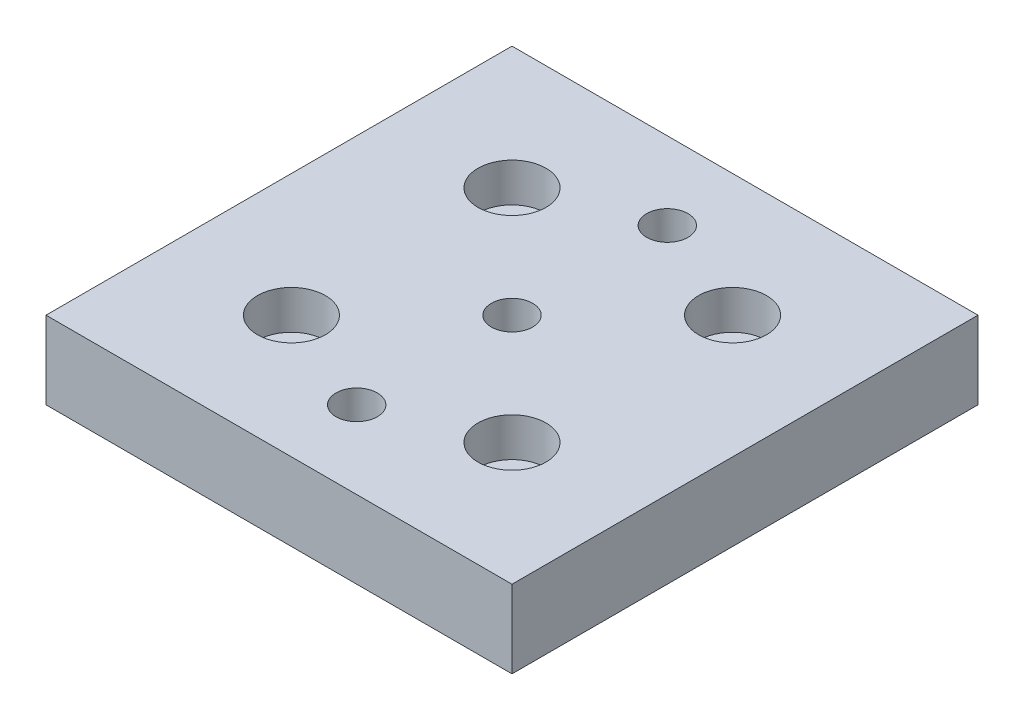
from build123d import *

# Parameters (mm, degrees)
SKETCH1_W                                        = 76.2
SKETCH1_H                                        = 76.2
BOSS_EXTRUDE1_DEPTH                              = 12.7
CBORE_FOR_1_4_SOCKET_HEAD_CAP_SCREW2_D           = 6.7564
CBORE_FOR_1_4_SOCKET_HEAD_CAP_SCREW2_CBORE_D     = 11.1125
CBORE_FOR_1_4_SOCKET_HEAD_CAP_SCREW2_CBORE_DEPTH = 6.35
CBORE_FOR_1_4_SOCKET_HEAD_CAP_SCREW1_D           = 6.7564
CBORE_FOR_1_4_SOCKET_HEAD_CAP_SCREW1_CBORE_D     = 11.1125
CBORE_FOR_1_4_SOCKET_HEAD_CAP_SCREW1_CBORE_DEPTH = 6.35


with BuildPart() as part:
    # Sketch1 → Boss-Extrude1 (new body)
    with BuildSketch(Plane(origin=(0, 0, 0), x_dir=(1, 0, 0), z_dir=(0, 1, 0))):
        Rectangle(SKETCH1_W, SKETCH1_H)
    extrude(amount=BOSS_EXTRUDE1_DEPTH)

    # CBORE for 1/4 Socket Head Cap Screw2 (through all)
    with Locations(Plane(origin=(0, 12.7, 0), x_dir=(1, 0, 0), z_dir=(0, 1, 0))):
        with Locations((-18.034, 18.034), (18.034, 18.034), (18.034, -18.034), (-18.034, -18.034)):
            CounterBoreHole(CBORE_FOR_1_4_SOCKET_HEAD_CAP_SCREW2_D / 2, CBORE_FOR_1_4_SOCKET_HEAD_CAP_SCREW2_CBORE_D / 2, CBORE_FOR_1_4_SOCKET_HEAD_CAP_SCREW2_CBORE_DEPTH)

    # CBORE for 1/4 Socket Head Cap Screw1 (through all)
    with Locations(Plane(origin=(0, 0, 0), x_dir=(-1, 0, 0), z_dir=(0, -1, 0))):
        with Locations((0, 25.4), (0, 0), (0, -25.4)):
            CounterBoreHole(CBORE_FOR_1_4_SOCKET_HEAD_CAP_SCREW1_D / 2, CBORE_FOR_1_4_SOCKET_HEAD_CAP_SCREW1_CBORE_D / 2, CBORE_FOR_1_4_SOCKET_HEAD_CAP_SCREW1_CBORE_DEPTH)


solid = part.part
